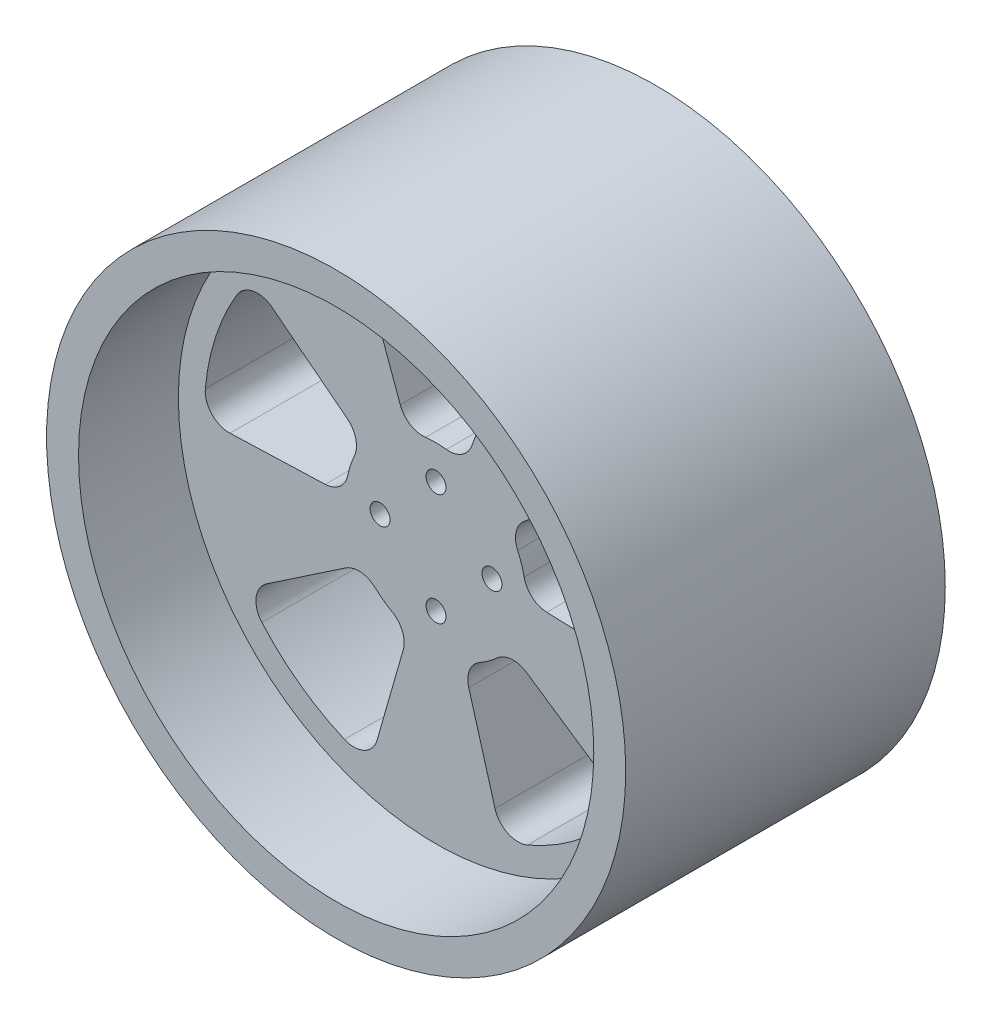
from build123d import *

# Parameters (mm, degrees)
SKETCH1_R           = 72.5
SKETCH1_R_2         = 64.5
BOSS_EXTRUDE1_DEPTH = 40
SKETCH4_R           = 64.5
BOSS_EXTRUDE3_DEPTH = 15
CUT_EXTRUDE1_DEPTH  = 15
SKETCH6_R           = 2.5
CUT_EXTRUDE2_DEPTH  = 30


with BuildPart() as part:
    # Sketch1 → Boss-Extrude1 (new, symmetric)
    with BuildSketch(Plane.XY):
        Circle(SKETCH1_R)
        Circle(SKETCH1_R_2, mode=Mode.SUBTRACT)
    extrude(amount=BOSS_EXTRUDE1_DEPTH, both=True)

    # Sketch4 → Boss-Extrude3 (add, symmetric)
    with BuildSketch(Plane.XY):
        Circle(SKETCH4_R)
    extrude(amount=BOSS_EXTRUDE3_DEPTH, both=True)

    # Sketch3 → Cut-Extrude1 (cut, symmetric)
    with BuildSketch(Plane.XY):
        with BuildLine():
            Line((8.942342186, 26.255693464), (17.100089792, 48.668920804))
            ThreePointArc((17.100089792, 48.668920804), (16.728172015, 53.596235201), (12.784464921, 56.573469548))
            ThreePointArc((12.784464921, 56.573469548), (0, 58), (-12.784464921, 56.573469548))
            ThreePointArc((-12.784464921, 56.573469548), (-16.728172015, 53.596235201), (-17.100089792, 48.668920804))
            Line((-17.100089792, 48.668920804), (-8.942342186, 26.255693464))
            ThreePointArc((-8.942342186, 26.255693464), (-6.454448371, 23.201362532), (-2.608568259, 22.348274467))
            ThreePointArc((-2.608568259, 22.348274467), (0, 22.5), (2.608568259, 22.348274467))
            ThreePointArc((2.608568259, 22.348274467), (6.454448371, 23.201362532), (8.942342186, 26.255693464))
        make_face()
        with BuildLine():
            Line((22.207312654, 16.618128287), (41.002675921, 31.302675452))
            ThreePointArc((41.002675921, 31.302675452), (45.803759299, 32.471584512), (49.853949939, 29.640912191))
            ThreePointArc((49.853949939, 29.640912191), (55.161277945, 17.922985674), (57.755183787, 5.323414851))
            ThreePointArc((57.755183787, 5.323414851), (56.142338174, 0.652710511), (51.571112622, -1.223628199))
            Line((51.571112622, -1.223628199), (27.733984064, -0.391217328))
            ThreePointArc((27.733984064, -0.391217328), (24.060341259, 1.031070133), (22.060563983, 4.425100764))
            ThreePointArc((22.060563983, 4.425100764), (21.398771617, 6.952882373), (20.448380136, 9.386892446))
            ThreePointArc((20.448380136, 9.386892446), (20.071272788, 13.308160497), (22.207312654, 16.618128287))
        make_face()
        with BuildLine():
            Line((22.667216205, -15.985125354), (42.44113714, -29.322803436))
            ThreePointArc((42.44113714, -29.322803436), (45.036452074, -33.527692304), (43.595900456, -38.254378356))
            ThreePointArc((43.595900456, -38.254378356), (34.091544633, -46.922985674), (22.910201686, -53.283418234))
            ThreePointArc((22.910201686, -53.283418234), (17.969701185, -53.19283792), (14.772610647, -49.42516462))
            Line((14.772610647, -49.42516462), (8.198202609, -26.49747907))
            ThreePointArc((8.198202609, -26.49747907), (8.415660309, -22.564126145), (11.025610093, -19.613411791))
            ThreePointArc((11.025610093, -19.613411791), (13.225168177, -18.202882373), (15.246362198, -16.546855886))
            ThreePointArc((15.246362198, -16.546855886), (18.859177151, -14.976467017), (22.667216205, -15.985125354))
        make_face()
        with BuildLine():
            Line((-8.198202609, -26.49747907), (-14.772610647, -49.42516462))
            ThreePointArc((-14.772610647, -49.42516462), (-17.969701185, -53.19283792), (-22.910201686, -53.283418234))
            ThreePointArc((-22.910201686, -53.283418234), (-34.091544633, -46.922985674), (-43.595900456, -38.254378356))
            ThreePointArc((-43.595900456, -38.254378356), (-45.036452074, -33.527692304), (-42.44113714, -29.322803436))
            Line((-42.44113714, -29.322803436), (-22.667216205, -15.985125354))
            ThreePointArc((-22.667216205, -15.985125354), (-18.859177151, -14.976467017), (-15.246362198, -16.546855886))
            ThreePointArc((-15.246362198, -16.546855886), (-13.225168177, -18.202882373), (-11.025610093, -19.613411791))
            ThreePointArc((-11.025610093, -19.613411791), (-8.415660309, -22.564126145), (-8.198202609, -26.49747907))
        make_face()
        with BuildLine():
            Line((-27.733984064, -0.391217328), (-51.571112622, -1.223628199))
            ThreePointArc((-51.571112622, -1.223628199), (-56.142338174, 0.652710511), (-57.755183787, 5.323414851))
            ThreePointArc((-57.755183787, 5.323414851), (-55.161277945, 17.922985674), (-49.853949939, 29.640912191))
            ThreePointArc((-49.853949939, 29.640912191), (-45.803759299, 32.471584512), (-41.002675921, 31.302675452))
            Line((-41.002675921, 31.302675452), (-22.207312654, 16.618128287))
            ThreePointArc((-22.207312654, 16.618128287), (-20.071272788, 13.308160497), (-20.448380136, 9.386892446))
            ThreePointArc((-20.448380136, 9.386892446), (-21.398771617, 6.952882373), (-22.060563983, 4.425100764))
            ThreePointArc((-22.060563983, 4.425100764), (-24.060341259, 1.031070133), (-27.733984064, -0.391217328))
        make_face()
    extrude(amount=CUT_EXTRUDE1_DEPTH, both=True, mode=Mode.SUBTRACT)

    # Sketch6 → Cut-Extrude2 (cut)
    with BuildSketch(Plane.XY.offset(15)):
        with Locations((0, 14)):
            Circle(SKETCH6_R)
        with Locations((14, 0)):
            Circle(SKETCH6_R)
        with Locations((0, -14)):
            Circle(SKETCH6_R)
        with Locations((-14, 0)):
            Circle(SKETCH6_R)
    extrude(amount=-CUT_EXTRUDE2_DEPTH, mode=Mode.SUBTRACT)


solid = part.part
